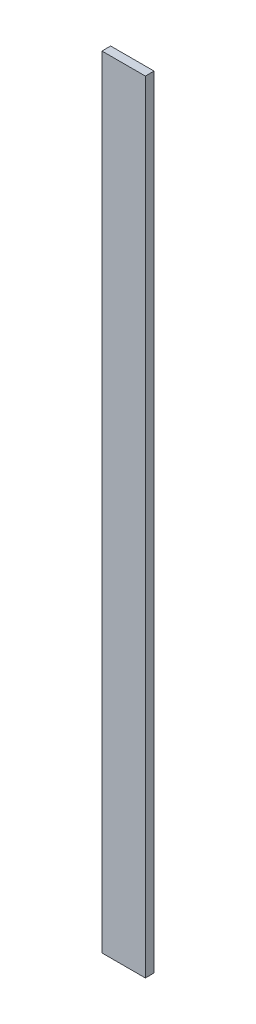
from build123d import *

# Parameters (mm, degrees)
SKETCH1_W           = 50
SKETCH1_H           = 10
BOSS_EXTRUDE1_DEPTH = 900


with BuildPart() as part:
    # Sketch1 → Boss-Extrude1 (new body)
    with BuildSketch(Plane(origin=(0, 0, 0), x_dir=(1, 0, 0), z_dir=(0, 1, 0))):
        Rectangle(SKETCH1_W, SKETCH1_H)
    extrude(amount=BOSS_EXTRUDE1_DEPTH)


solid = part.part
